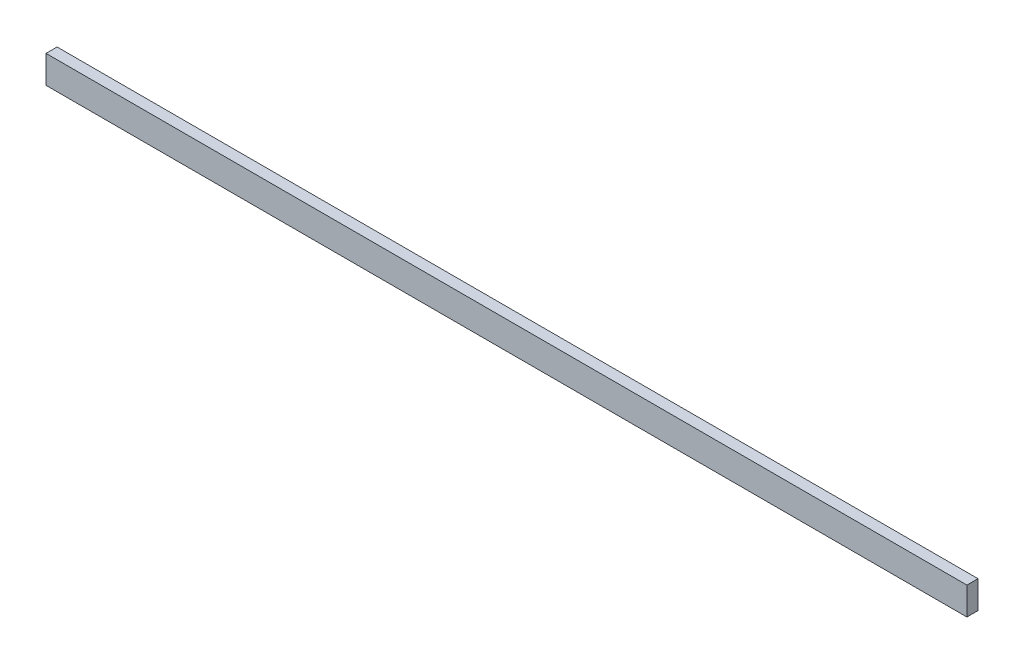
from build123d import *

# Parameters (mm, degrees)
SKETCH1_W           = 665
SKETCH1_H           = 20
BOSS_EXTRUDE1_DEPTH = 8


with BuildPart() as part:
    # Sketch1 → Boss-Extrude1 (new body)
    with BuildSketch(Plane.XY):
        Rectangle(SKETCH1_W, SKETCH1_H)
    extrude(amount=BOSS_EXTRUDE1_DEPTH)


solid = part.part
